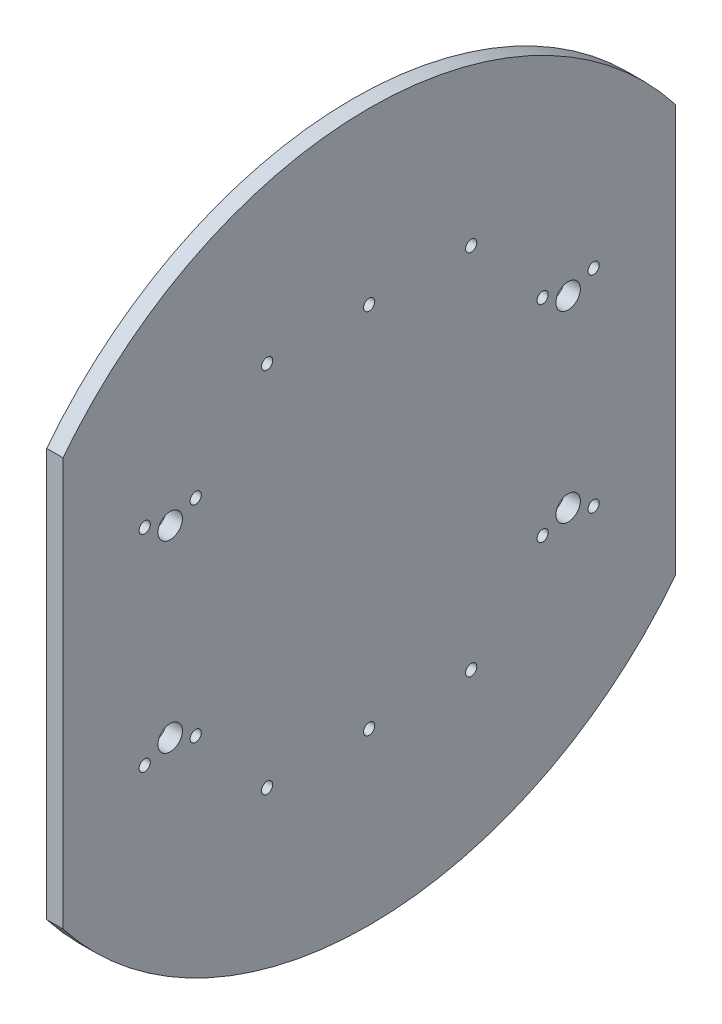
from build123d import *

# Parameters (mm, degrees)
EXTRUDE_1_DEPTH     = 8
SKETCH_2_R          = 6
SKETCH_2_R_2        = 2.75
CUT_EXTRUDE_1_DEPTH = 8
SKETCH_3_R          = 2.75
CUT_EXTRUDE_2_DEPTH = 10


with BuildPart() as part:
    # 草图1 → 凸台-拉伸1 (new body)
    with BuildSketch(Plane(origin=(0, 0, 0), x_dir=(0, 0, -1), z_dir=(1, 0, 0))):
        with BuildLine():
            Line((-150, 100), (-150, -100))
            ThreePointArc((-150, -100), (0, -173.380962103), (150, -100))
            Line((150, -100), (150, 100))
            ThreePointArc((150, 100), (0, 173.380962103), (-150, 100))
        make_face()
    extrude(amount=EXTRUDE_1_DEPTH)

    # 草图2 → 切除-拉伸1 (cut)
    with BuildSketch(Plane(origin=(8, 0, 0), x_dir=(0, 0, -1), z_dir=(1, 0, 0))):
        with Locations((97.5, 45)):
            Circle(SKETCH_2_R)
        with Locations((97.5, -45)):
            Circle(SKETCH_2_R)
        with Locations((85, 50.5)):
            Circle(SKETCH_2_R_2)
        with Locations((110, 50.5)):
            Circle(SKETCH_2_R_2)
        with Locations((85, -50.5)):
            Circle(SKETCH_2_R_2)
        with Locations((110, -50.5)):
            Circle(SKETCH_2_R_2)
        with Locations(Location((-110, -50.5, 0), (0, 0, 180))):
            Circle(SKETCH_2_R_2)
        with Locations(Location((-85, -50.5, 0), (0, 0, 180))):
            Circle(SKETCH_2_R_2)
        with Locations(Location((-110, 50.5, 0), (0, 0, 180))):
            Circle(SKETCH_2_R_2)
        with Locations(Location((-85, 50.5, 0), (0, 0, 180))):
            Circle(SKETCH_2_R_2)
        with Locations(Location((-97.5, -45, 0), (0, 0, 180))):
            Circle(SKETCH_2_R)
        with Locations(Location((-97.5, 45, 0), (0, 0, 180))):
            Circle(SKETCH_2_R)
    extrude(amount=-CUT_EXTRUDE_1_DEPTH, mode=Mode.SUBTRACT)

    # 草图3 → 切除-拉伸2 (cut)
    with BuildSketch(Plane(origin=(8, 0, 0), x_dir=(0, 0, -1), z_dir=(1, 0, 0))):
        with Locations((-50, 90)):
            Circle(SKETCH_3_R)
        with Locations((0, 90)):
            Circle(SKETCH_3_R)
        with Locations((50, 90)):
            Circle(SKETCH_3_R)
        with Locations((50, -90)):
            Circle(SKETCH_3_R)
        with Locations((0, -90)):
            Circle(SKETCH_3_R)
        with Locations((-50, -90)):
            Circle(SKETCH_3_R)
    extrude(amount=-CUT_EXTRUDE_2_DEPTH, mode=Mode.SUBTRACT)


solid = part.part
